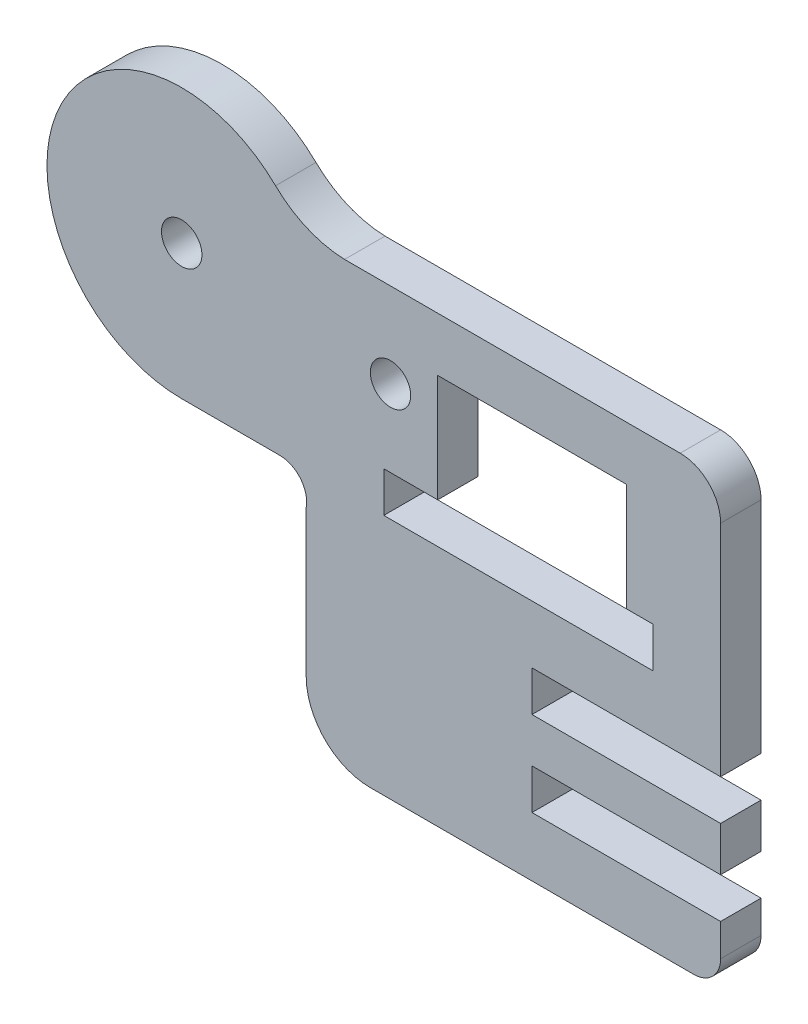
from build123d import *

# Parameters (mm, degrees)
BOSS_EXTRUDE1_DEPTH = 3
SKETCH2_R           = 1.5
CUT_EXTRUDE1_DEPTH  = 3
SKETCH3_W           = 20
SKETCH3_H           = 3
SKETCH3_W_2         = 14
CUT_EXTRUDE2_DEPTH  = 3
SKETCH4_W           = 14
SKETCH4_H           = 8
CUT_EXTRUDE3_DEPTH  = 3
SKETCH5_R           = 1.5
CUT_EXTRUDE4_DEPTH  = 3


with BuildPart() as part:
    # Sketch1 → Boss-Extrude1 (new body)
    with BuildSketch(Plane.XY):
        with BuildLine():
            Line((10.270588235, 0.331568073), (10.270588235, -27.668431927))
            ThreePointArc((10.270588235, -27.668431927), (9.684801798, -29.08264549), (8.270588235, -29.668431927))
            Line((8.270588235, -29.668431927), (-15.729411765, -29.668431927))
            ThreePointArc((-15.729411765, -29.668431927), (-19.09389159, -28.274818754), (-20.487504763, -24.910338929))
            Line((-20.487504763, -24.910338929), (-20.487504763, -14.033468446))
            ThreePointArc((-20.487504763, -14.033468446), (-20.916042168, -12.389775022), (-22.453909691, -11.668431927))
            Line((-22.453909691, -11.668431927), (-29.729411765, -11.668431927))
            ThreePointArc((-29.729411765, -11.668431927), (-36.800479577, -8.739499739), (-39.729411765, -1.668431927))
            ThreePointArc((-39.729411765, -1.668431927), (-36.800479577, 5.402635884), (-29.729411765, 8.331568073))
            ThreePointArc((-29.729411765, 8.331568073), (-25.969894889, 7.597960729), (-22.761979852, 5.504774645))
            ThreePointArc((-22.761979852, 5.504774645), (-20.403371026, 3.939172769), (-17.6384187, 3.331568073))
            Line((-17.6384187, 3.331568073), (7.270588235, 3.331568073))
            ThreePointArc((7.270588235, 3.331568073), (9.391908579, 2.452888416), (10.270588235, 0.331568073))
        make_face()
    extrude(amount=BOSS_EXTRUDE1_DEPTH)

    # Sketch2 → Cut-Extrude1 (cut)
    with BuildSketch(Plane.XY.offset(3)):
        with Locations((-29.729411765, -1.668431927)):
            Circle(SKETCH2_R)
    extrude(amount=-CUT_EXTRUDE1_DEPTH, mode=Mode.SUBTRACT)

    # Sketch3 → Cut-Extrude2 (cut)
    with BuildSketch(Plane.XY.offset(3)):
        with Locations((-4.729411765, -10.168431927)):
            Rectangle(SKETCH3_W, SKETCH3_H)
        with Locations((3.270588235, -17.468431927)):
            Rectangle(SKETCH3_W_2, SKETCH3_H)
        with Locations((3.270588235, -23.768431927)):
            Rectangle(SKETCH3_W_2, SKETCH3_H)
    extrude(amount=-CUT_EXTRUDE2_DEPTH, mode=Mode.SUBTRACT)

    # Sketch4 → Cut-Extrude3 (cut)
    with BuildSketch(Plane.XY.offset(3)):
        with Locations((-3.729411765, -4.668431927)):
            Rectangle(SKETCH4_W, SKETCH4_H)
    extrude(amount=-CUT_EXTRUDE3_DEPTH, mode=Mode.SUBTRACT)

    # Sketch5 → Cut-Extrude4 (cut)
    with BuildSketch(Plane.XY.offset(3)):
        with Locations((-14.229411765, -2.968431927)):
            Circle(SKETCH5_R)
    extrude(amount=-CUT_EXTRUDE4_DEPTH, mode=Mode.SUBTRACT)


solid = part.part
